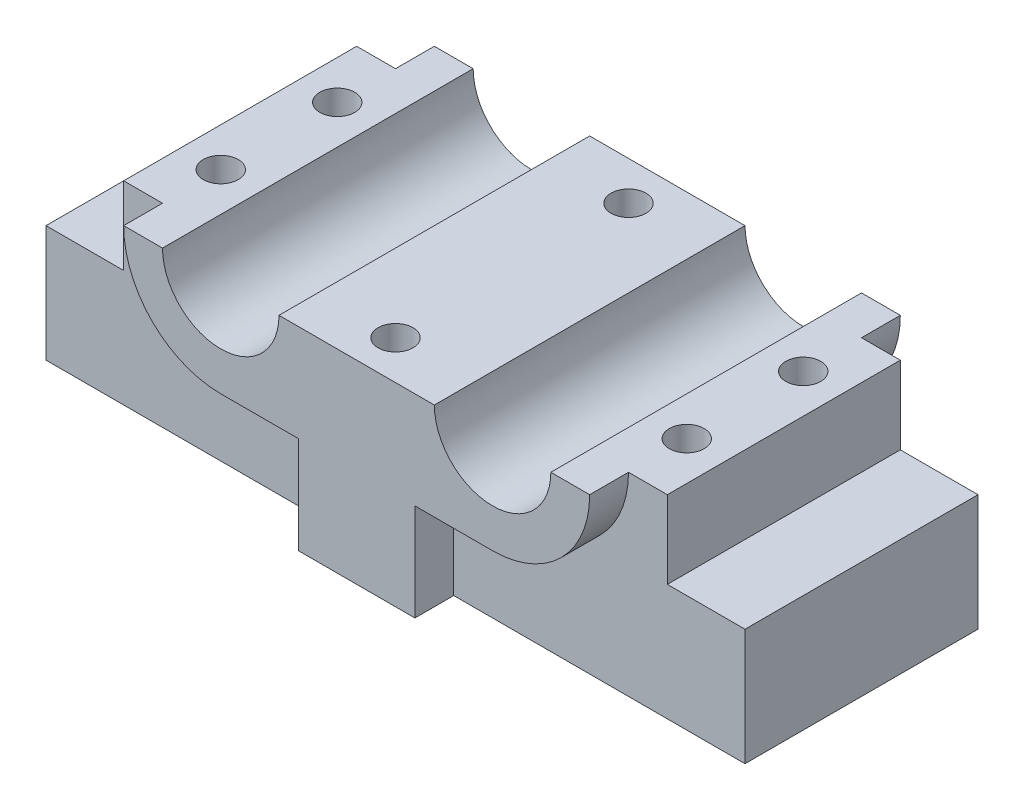
from build123d import *

# Parameters (mm, degrees)
SKETCH1_W            = 90
SKETCH1_H            = 25
BOSS_EXTRUDE1_DEPTH  = 20
SKETCH2_W            = 10
SKETCH2_H            = 10
CUT_EXTRUDE1_DEPTH   = 40
CUT_EXTRUDE2_DEPTH   = 5
CUT_EXTRUDE3_REACH   = 63.492
HOLE1_D              = 4.5
LPATTERN1_COUNT      = 2
LPATTERN1_PITCH      = 60
LPATTERN1_COUNT_DIR2 = 2
LPATTERN1_PITCH_DIR2 = 15
HOLE2_D              = 4.5


with BuildPart() as part:
    # Sketch1 → Boss-Extrude1 (new, symmetric)
    with BuildSketch(Plane.XY):
        Rectangle(SKETCH1_W, SKETCH1_H)
    extrude(amount=BOSS_EXTRUDE1_DEPTH, both=True)

    # Sketch2 → Cut-Extrude1 (cut)
    with BuildSketch(Plane.XY.offset(20)):
        with Locations((40, 7.5)):
            Rectangle(SKETCH2_W, SKETCH2_H)
        with Locations((-40, 7.5)):
            Rectangle(SKETCH2_W, SKETCH2_H)
    extrude(amount=-CUT_EXTRUDE1_DEPTH, mode=Mode.SUBTRACT)

    # Sketch3 → Cut-Extrude2 (cut)
    with BuildSketch(Plane.XY.offset(20)):
        with BuildLine():
            Line((17.5, 0), (7.5, 0))
            Line((7.5, 0), (7.5, -12.5))
            Line((7.5, -12.5), (45, -12.5))
            Line((45, -12.5), (45, 2.5))
            Line((45, 2.5), (35, 2.5))
            Line((35, 2.5), (35, 12.5))
            Line((35, 12.5), (30, 12.5))
            ThreePointArc((30, 12.5), (26.338834765, 3.661165235), (17.5, 0))
        make_face()
        with BuildLine():
            Line((-35, 2.5), (-35, 12.5))
            Line((-35, 12.5), (-30, 12.5))
            ThreePointArc((-30, 12.5), (-26.338834765, 3.661165235), (-17.5, 0))
            Line((-17.5, 0), (-7.5, 0))
            Line((-7.5, 0), (-7.5, -12.5))
            Line((-7.5, -12.5), (-45, -12.5))
            Line((-45, -12.5), (-45, 2.5))
            Line((-45, 2.5), (-35, 2.5))
        make_face()
    cut_extrude2 = extrude(amount=-CUT_EXTRUDE2_DEPTH, mode=Mode.SUBTRACT)

    # Mirror1: Cut-Extrude2 across plane
    add(cut_extrude2.mirror(Plane.XY), mode=Mode.SUBTRACT)

    # Sketch4 → Cut-Extrude3 (cut, up to next)
    with BuildSketch(Plane.XY.offset(20), mode=Mode.PRIVATE) as cut_extrude3_sk1:
        with BuildLine():
            Line((-25, 12.5), (-10, 12.5))
            ThreePointArc((-10, 12.5), (-17.5, 5), (-25, 12.5))
        make_face()
    cut_extrude3_tool1 = extrude(cut_extrude3_sk1.sketch, amount=-CUT_EXTRUDE3_REACH, mode=Mode.PRIVATE) & part.part
    # Sketch4 → Cut-Extrude3 (cut, up to next)
    with BuildSketch(Plane.XY.offset(20), mode=Mode.PRIVATE) as cut_extrude3_sk2:
        with BuildLine():
            Line((10, 12.5), (25, 12.5))
            ThreePointArc((25, 12.5), (17.5, 5), (10, 12.5))
        make_face()
    cut_extrude3_tool2 = extrude(cut_extrude3_sk2.sketch, amount=-CUT_EXTRUDE3_REACH, mode=Mode.PRIVATE) & part.part
    add(cut_extrude3_tool1.solids().sort_by_distance((-17.5, 9.316901, 20))[0], mode=Mode.SUBTRACT)
    add(cut_extrude3_tool2.solids().sort_by_distance((17.5, 9.316901, 20))[0], mode=Mode.SUBTRACT)

    # Hole1 (through all)
    with Locations(Plane(origin=(0, 12.5, 0), x_dir=(1, 0, 0), z_dir=(0, 1, 0))):
        with Locations((30, -7.5)):
            hole1 = Hole(HOLE1_D / 2)

    # LPattern1: Hole1 2 × 2
    with Locations(*[(-i * LPATTERN1_PITCH, 0, -j * LPATTERN1_PITCH_DIR2) for i in range(LPATTERN1_COUNT) for j in range(LPATTERN1_COUNT_DIR2) if (i, j) != (0, 0)]):
        add(hole1, mode=Mode.SUBTRACT)

    # Hole2 (through all)
    with Locations(Plane(origin=(0, 12.5, 0), x_dir=(1, 0, 0), z_dir=(0, 1, 0))):
        with Locations((0, -15)):
            hole2 = Hole(HOLE2_D / 2)

    # Mirror2: Hole2 across plane
    add(hole2.mirror(Plane.XY), mode=Mode.SUBTRACT)


solid = part.part
